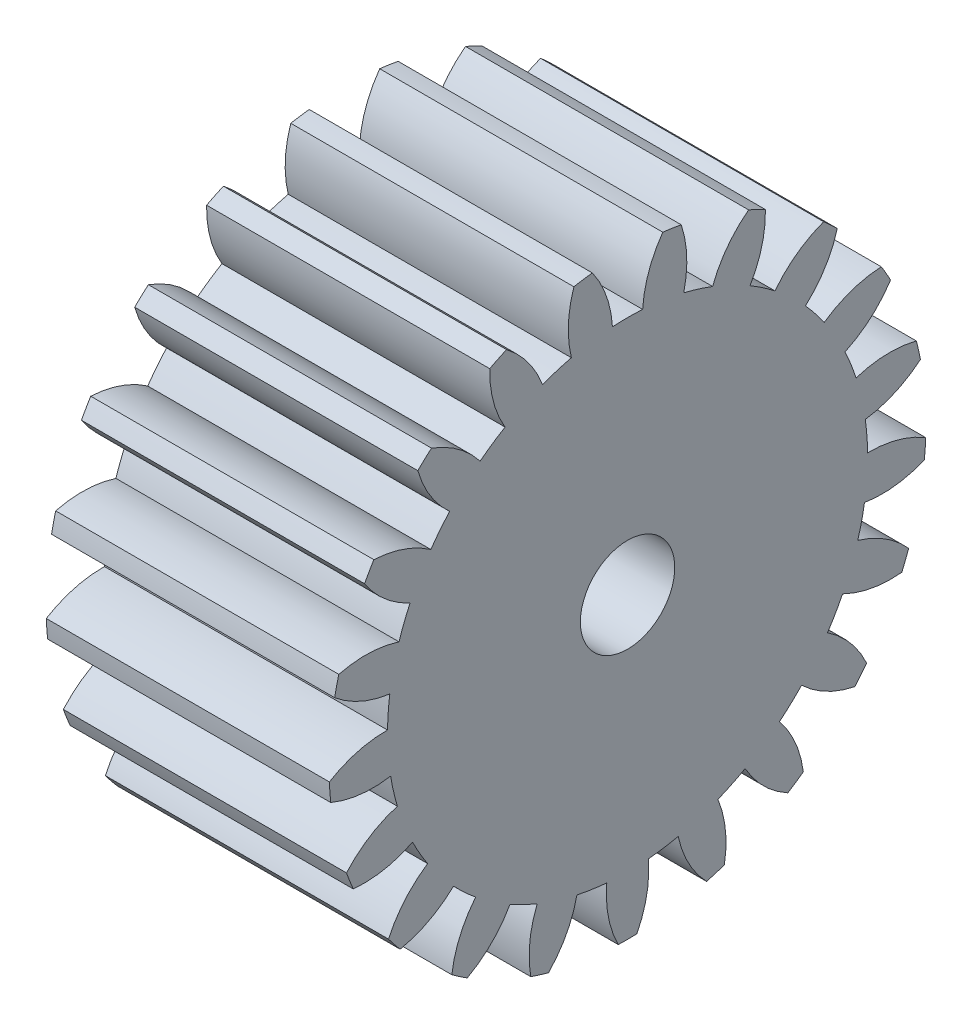
from build123d import *

# Parameters (mm, degrees)
BASPROSKE_W     = 15
BASPROSKE_H     = 15.8125
TOOTHCUT_DEPTH  = 27.927129674
TEETHCUTS_COUNT = 21
BORSKE_R        = 2.5
BORE_DEPTH      = 50.0000508


with BuildPart() as part:
    # BasProSke → Base-Revolve (revolve)
    with BuildSketch(Plane(origin=(0, 0, 0), x_dir=(1, 0, 0), z_dir=(0, 1, 0)), mode=Mode.PRIVATE) as base_revolve_sk:
        with Locations((7.5, 7.90625)):
            Rectangle(BASPROSKE_W, BASPROSKE_H)
    revolve(base_revolve_sk.sketch.rotate(Axis((-10, 0, 0), (1, 0, 0)), 180), axis=Axis((-10, 0, 0), (1, 0, 0)))

    # TooCutSke → ToothCut (cut, through all)
    with BuildSketch(Plane(origin=(0, 0, 0), x_dir=(0, 0, -1), z_dir=(1, 0, 0))):
        with BuildLine():
            ThreePointArc((0.799356262, 12.692603934), (0, 12.71775), (-0.799356262, 12.692603934))
            ThreePointArc((-0.799356262, 12.692603934), (-1.126185367, 14.286181481), (-1.884464628, 15.725389327))
            ThreePointArc((-1.884464628, 15.725389327), (0, 15.8379), (1.884464628, 15.725389327))
            ThreePointArc((1.884464628, 15.725389327), (1.126185367, 14.286181481), (0.799356262, 12.692603934))
        make_face()
    toothcut = extrude(amount=TOOTHCUT_DEPTH, mode=Mode.SUBTRACT)

    # TeethCuts: ToothCut ×21 about axis
    teethcuts_axis = Axis((0, 0, 0), (1, 0, 0))
    for i in range(1, TEETHCUTS_COUNT):
        add(toothcut.rotate(teethcuts_axis, i * 360 / TEETHCUTS_COUNT), mode=Mode.SUBTRACT)

    # BorSke → Bore (cut, symmetric)
    with BuildSketch(Plane(origin=(0, 0, 0), x_dir=(0, 0, -1), z_dir=(1, 0, 0))):
        with Locations(Location((0, 0, 0), (0, 0, 180))):
            Circle(BORSKE_R)
    extrude(amount=BORE_DEPTH, both=True, mode=Mode.SUBTRACT)


solid = part.part
